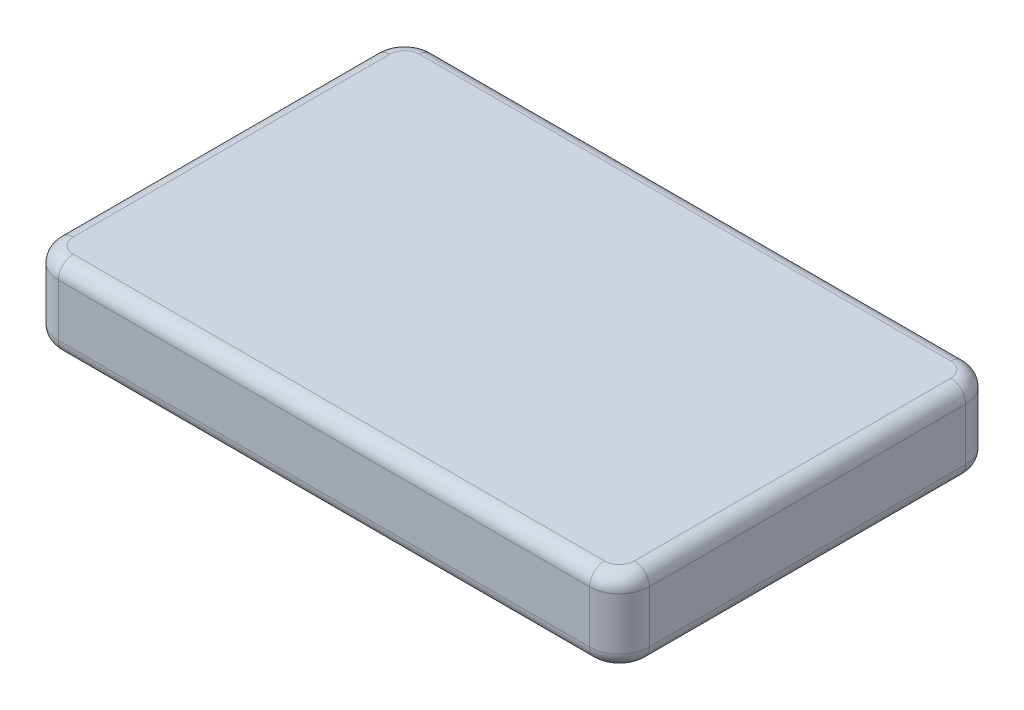
from build123d import *

# Parameters (mm, degrees)
CROQUIS1_W              = 39.6
CROQUIS1_H              = 25.2
SALIENTE_EXTRUIR1_DEPTH = 5.5
REDONDEO1_R             = 2
REDONDEO2_R             = 2
REDONDEO3_R             = 2
REDONDEO4_R             = 2
REDONDEO5_R             = 1


with BuildPart() as part:
    # Croquis1 → Saliente-Extruir1 (new body)
    with BuildSketch(Plane(origin=(0, 0, 0), x_dir=(1, 0, 0), z_dir=(0, 1, 0))):
        Rectangle(CROQUIS1_W, CROQUIS1_H)
    extrude(amount=SALIENTE_EXTRUIR1_DEPTH)

    # Redondeo1
    redondeo1_edges = [part.edges().sort_by_distance(p)[0] for p in [
        (-19.8, 2.75, 12.6),
    ]]
    fillet(redondeo1_edges, radius=REDONDEO1_R)

    # Redondeo2
    redondeo2_edges = [part.edges().sort_by_distance(p)[0] for p in [
        (19.8, 2.75, 12.6),
    ]]
    fillet(redondeo2_edges, radius=REDONDEO2_R)

    # Redondeo3
    redondeo3_edges = [part.edges().sort_by_distance(p)[0] for p in [
        (19.8, 2.75, -12.6),
    ]]
    fillet(redondeo3_edges, radius=REDONDEO3_R)

    # Redondeo4
    redondeo4_edges = [part.edges().sort_by_distance(p)[0] for p in [
        (-19.8, 2.75, -12.6),
    ]]
    fillet(redondeo4_edges, radius=REDONDEO4_R)

    # Redondeo5
    redondeo5_edges = [part.edges().sort_by_distance(p)[0] for p in [
        (0, 0, 12.6),
        (0, 5.5, 12.6),
        (-19.214213562, 0, 12.014213562),
        (-19.214213562, 5.5, 12.014213562),
        (19.8, 0, 0),
        (19.8, 5.5, 0),
        (19.214213562, 0, 12.014213562),
        (19.214213562, 5.5, 12.014213562),
        (0, 0, -12.6),
        (0, 5.5, -12.6),
        (19.214213562, 0, -12.014213562),
        (19.214213562, 5.5, -12.014213562),
        (-19.8, 0, 0),
        (-19.8, 5.5, 0),
        (-19.214213562, 0, -12.014213562),
        (-19.214213562, 5.5, -12.014213562),
    ]]
    fillet(redondeo5_edges, radius=REDONDEO5_R)


solid = part.part
